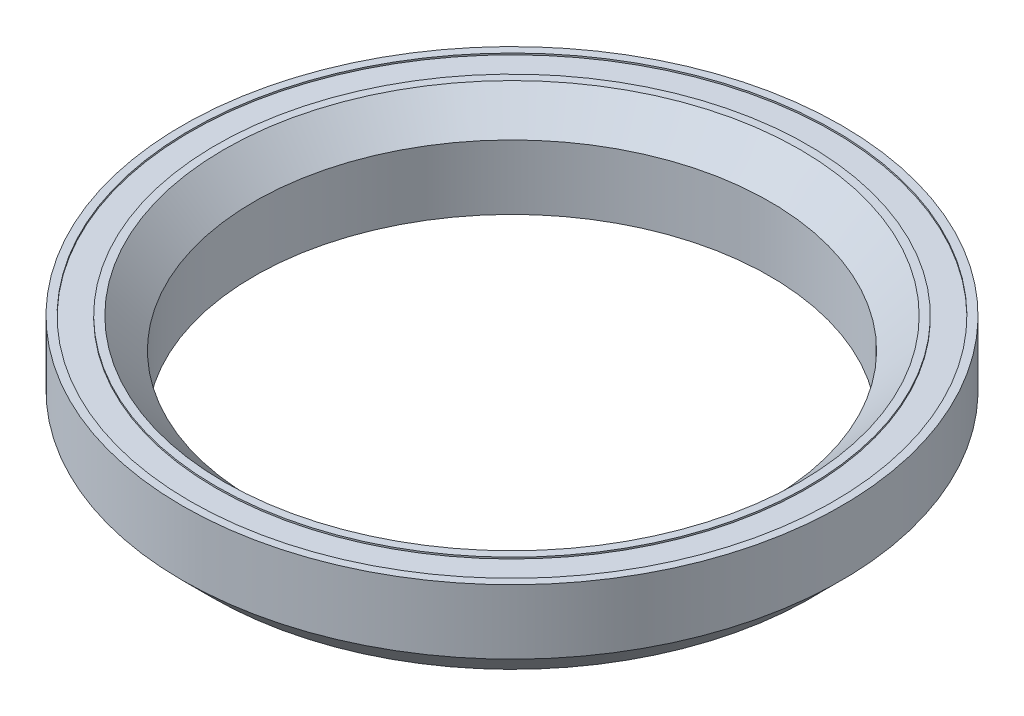
from build123d import *

# Parameters (mm, degrees)
SKETCH_3_R          = 20.4
SKETCH_3_R_2        = 18.76
CUT_EXTRUDE_1_DEPTH = 0.1
SKETCH_4_R          = 18.49
SKETCH_4_R_2        = 16.85
CUT_EXTRUDE_2_DEPTH = 0.1


with BuildPart() as part:
    # 草图2 → 旋转1 (revolve)
    with BuildSketch(Plane(origin=(0, 0, 0), x_dir=(0, 0, -1), z_dir=(1, 0, 0))):
        Polygon((-20.9, 1.91), (-20.9, 6), (-18.26, 6), (-16.35, 4.09), (-16.35, 0), (-18.99, 0), align=None)
    revolve(axis=Axis((0, 0, 0), (0, -1, 0)))

    # 草图3 → 切除-拉伸1 (cut)
    with BuildSketch(Plane(origin=(0, 6, 0), x_dir=(1, 0, 0), z_dir=(0, 1, 0))):
        with Locations(Location((0, 0, 0), (0, 0, 270))):
            Circle(SKETCH_3_R)
        with Locations(Location((0, 0, 0), (0, 0, 270))):
            Circle(SKETCH_3_R_2, mode=Mode.SUBTRACT)
    extrude(amount=-CUT_EXTRUDE_1_DEPTH, mode=Mode.SUBTRACT)

    # 草图4 → 切除-拉伸2 (cut)
    with BuildSketch(Plane.XZ):
        with Locations(Location((0, 0, 0), (0, 0, 270))):
            Circle(SKETCH_4_R)
        with Locations(Location((0, 0, 0), (0, 0, 270))):
            Circle(SKETCH_4_R_2, mode=Mode.SUBTRACT)
    extrude(amount=-CUT_EXTRUDE_2_DEPTH, mode=Mode.SUBTRACT)


solid = part.part
